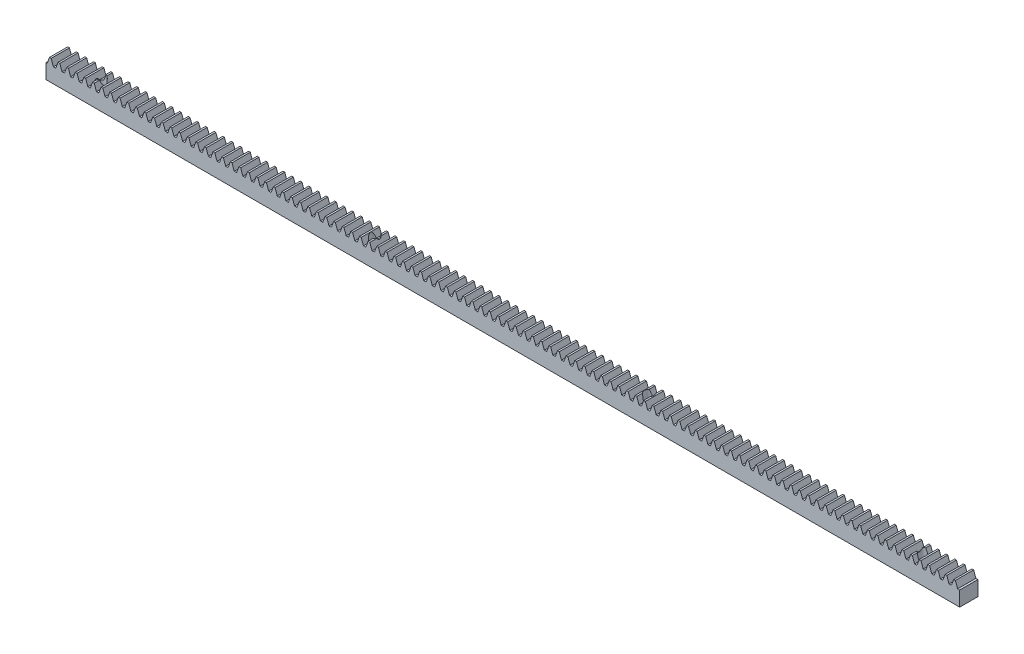
from build123d import *

# Parameters (mm, degrees)
BLANKSKE_W          = 1000
BLANKSKE_H          = 23
BLANK_DEPTH         = 20
TOOTHCUTSIM_DEPTH   = 1001.46439217
TEETHCUTS_COUNT     = 107
TEETHCUTS_PITCH     = 9.42477795
SKETCH_1_R          = 2.5
CUT_EXTRUDE_1_DEPTH = 1001.46439217
SKETCH_2_R          = 5
CUT_EXTRUDE_3_DEPTH = 30


with BuildPart() as part:
    # BlankSke → Blank (new body)
    with BuildSketch(Plane.XY):
        with Locations((500, 11.5)):
            Rectangle(BLANKSKE_W, BLANKSKE_H)
    extrude(amount=-BLANK_DEPTH)

    # TooCutSkeSim → ToothCutSim (cut, through all)
    with BuildSketch(Plane.XY):
        Polygon((1.312306109, 16.25), (-1.312306109, 16.25), (-3.778350034, 23.0254), (3.778350034, 23.0254), align=None)
    toothcutsim = extrude(amount=-TOOTHCUTSIM_DEPTH, mode=Mode.SUBTRACT)

    # TeethCuts: ToothCutSim ×107
    with Locations(*[(i * TEETHCUTS_PITCH, 0, 0) for i in range(1, TEETHCUTS_COUNT)]):
        add(toothcutsim, mode=Mode.SUBTRACT)

    # 草图1 → 切除-拉伸1 (cut, through all)
    with BuildSketch(Plane.XZ):
        with Locations(Location((50, -10, 0), (0, 0, 270))):
            Circle(SKETCH_1_R)
        with Locations(Location((350, -10, 0), (0, 0, 270))):
            Circle(SKETCH_1_R)
        with Locations(Location((650, -10, 0), (0, 0, 270))):
            Circle(SKETCH_1_R)
        with Locations(Location((950, -10, 0), (0, 0, 270))):
            Circle(SKETCH_1_R)
    extrude(amount=-CUT_EXTRUDE_1_DEPTH, mode=Mode.SUBTRACT)

    # 草图2 → 切除-拉伸3 (cut)
    with BuildSketch(Plane(origin=(0, 40, 0), x_dir=(-1, 0, 0), z_dir=(0, -1, 0))):
        with Locations(Location((-950, 10, 0), (0, 0, 263.22022979))):
            Circle(SKETCH_2_R)
        with Locations(Location((-650, 10, 0), (0, 0, 281.567691207))):
            Circle(SKETCH_2_R)
        with Locations(Location((-350, 10, 0), (0, 0, 269.666648306))):
            Circle(SKETCH_2_R)
        with Locations(Location((-50, 10, 0), (0, 0, 259.711834547))):
            Circle(SKETCH_2_R)
    extrude(amount=CUT_EXTRUDE_3_DEPTH, mode=Mode.SUBTRACT)


solid = part.part
